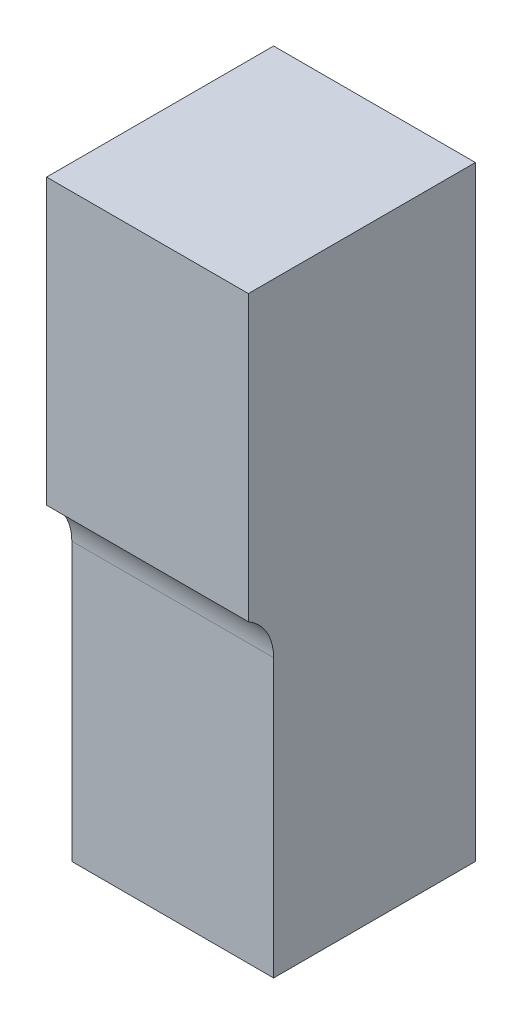
from build123d import *

# Parameters (mm, degrees)
BOSS_EXTRUDE1_DEPTH = 25.4


with BuildPart() as part:
    # Sketch1 → Boss-Extrude1 (new body)
    with BuildSketch(Plane.YZ):
        with BuildLine():
            Line((0, 0), (76.2, 0))
            Line((76.2, 0), (76.2, 28.575))
            Line((76.2, 28.575), (40.424261314, 28.575))
            ThreePointArc((40.424261314, 28.575), (38.1, 26.250738686), (34.925, 25.4))
            Line((34.925, 25.4), (0, 25.4))
            Line((0, 25.4), (0, 0))
        make_face()
    extrude(amount=BOSS_EXTRUDE1_DEPTH)


solid = part.part
